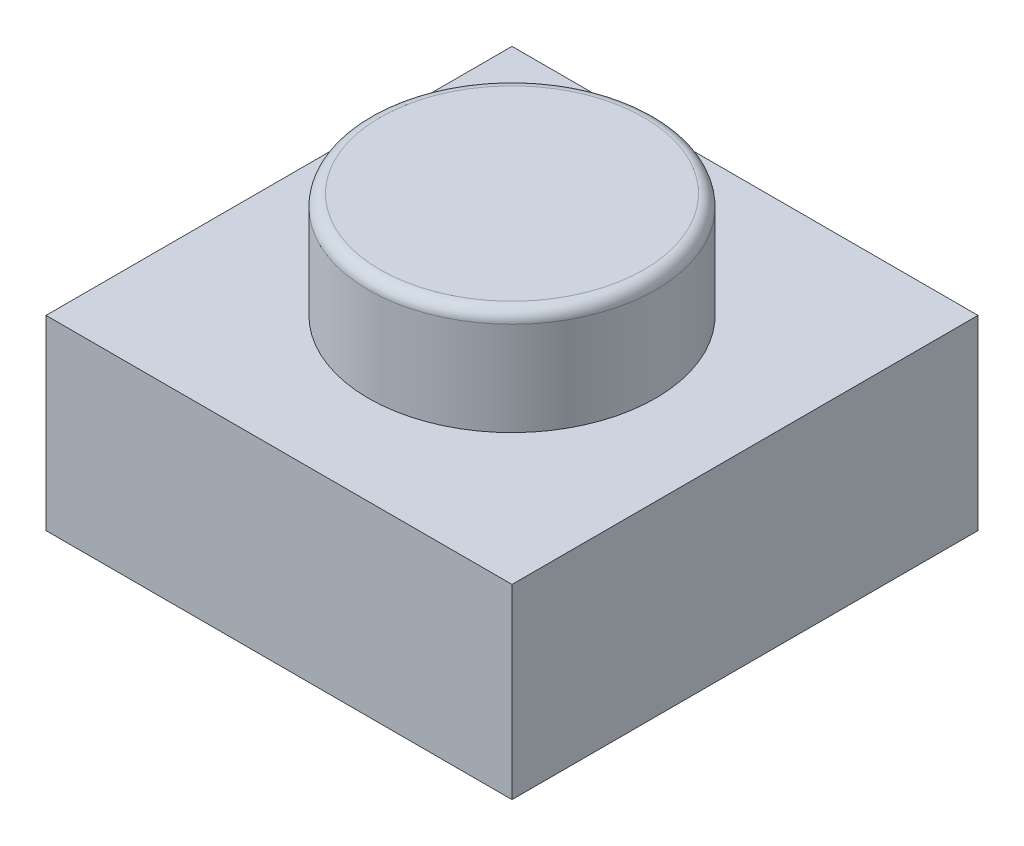
from build123d import *

# Parameters (mm, degrees)
SKETCH_1_W      = 7.95
SKETCH_1_H      = 7.95
EXTRUDE_1_DEPTH = 3.18
SKETCH_2_R      = 2.45
EXTRUDE_2_DEPTH = 1.8
FILLET_1_R      = 0.2


with BuildPart() as part:
    # 草图1 → 凸台-拉伸1 (new body)
    with BuildSketch(Plane(origin=(0, 0, 0), x_dir=(1, 0, 0), z_dir=(0, 1, 0))):
        with Locations((27.642590822, 13.353871893)):
            Rectangle(SKETCH_1_W, SKETCH_1_H)
    extrude(amount=EXTRUDE_1_DEPTH)

    # 草图2 → 凸台-拉伸2 (add)
    with BuildSketch(Plane(origin=(0, 3.18, 0), x_dir=(1, 0, 0), z_dir=(0, 1, 0))):
        with Locations(Location((27.642590822, 13.353871893, 0), (0, 0, 270))):
            Circle(SKETCH_2_R)
    extrude(amount=EXTRUDE_2_DEPTH)

    # 圆角1
    fillet_1_edges = [part.edges().sort_by_distance(p)[0] for p in [
        (27.642590822, 4.98, -15.803871893),
    ]]
    fillet(fillet_1_edges, radius=FILLET_1_R)


solid = part.part
